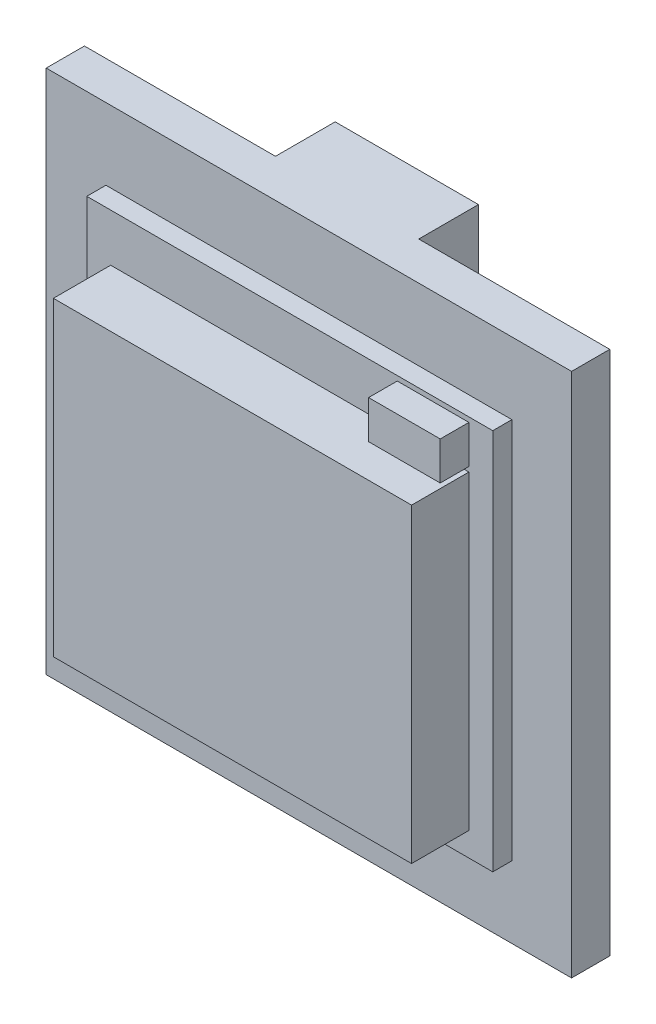
from build123d import *

# Parameters (mm, degrees)
SKETCH1_W           = 6
SKETCH1_H           = 22
BOSS_EXTRUDE1_DEPTH = 2.5
SKETCH2_W           = 22
SKETCH2_H           = 22
BOSS_EXTRUDE2_DEPTH = 1.6
SKETCH3_W           = 17
SKETCH3_H           = 16
BOSS_EXTRUDE3_DEPTH = 0.8
SKETCH4_W           = 15
SKETCH4_H           = 13
BOSS_EXTRUDE4_DEPTH = 2.4
SKETCH5_W           = 3
SKETCH5_H           = 1.6
BOSS_EXTRUDE5_DEPTH = 1.2


with BuildPart() as part:
    # Sketch1 → Boss-Extrude1 (new body)
    with BuildSketch(Plane.XY.offset(10.6)):
        with Locations((18, 64)):
            Rectangle(SKETCH1_W, SKETCH1_H)
    extrude(amount=BOSS_EXTRUDE1_DEPTH)

    # Sketch2 → Boss-Extrude2 (add)
    with BuildSketch(Plane.XY.offset(13.1)):
        with Locations((18, 64)):
            Rectangle(SKETCH2_W, SKETCH2_H)
    extrude(amount=BOSS_EXTRUDE2_DEPTH)

    # Sketch3 → Boss-Extrude3 (add)
    with BuildSketch(Plane.XY.offset(14.7)):
        with Locations((18, 64)):
            Rectangle(SKETCH3_W, SKETCH3_H)
    extrude(amount=BOSS_EXTRUDE3_DEPTH)

    # Sketch4 → Boss-Extrude4 (add)
    with BuildSketch(Plane.XY.offset(15.5)):
        with Locations((18, 63.5)):
            Rectangle(SKETCH4_W, SKETCH4_H)
    extrude(amount=BOSS_EXTRUDE4_DEPTH)

    # Sketch5 → Boss-Extrude5 (add)
    with BuildSketch(Plane.XY.offset(15.5)):
        with Locations((24, 71)):
            Rectangle(SKETCH5_W, SKETCH5_H)
    extrude(amount=BOSS_EXTRUDE5_DEPTH)


solid = part.part
